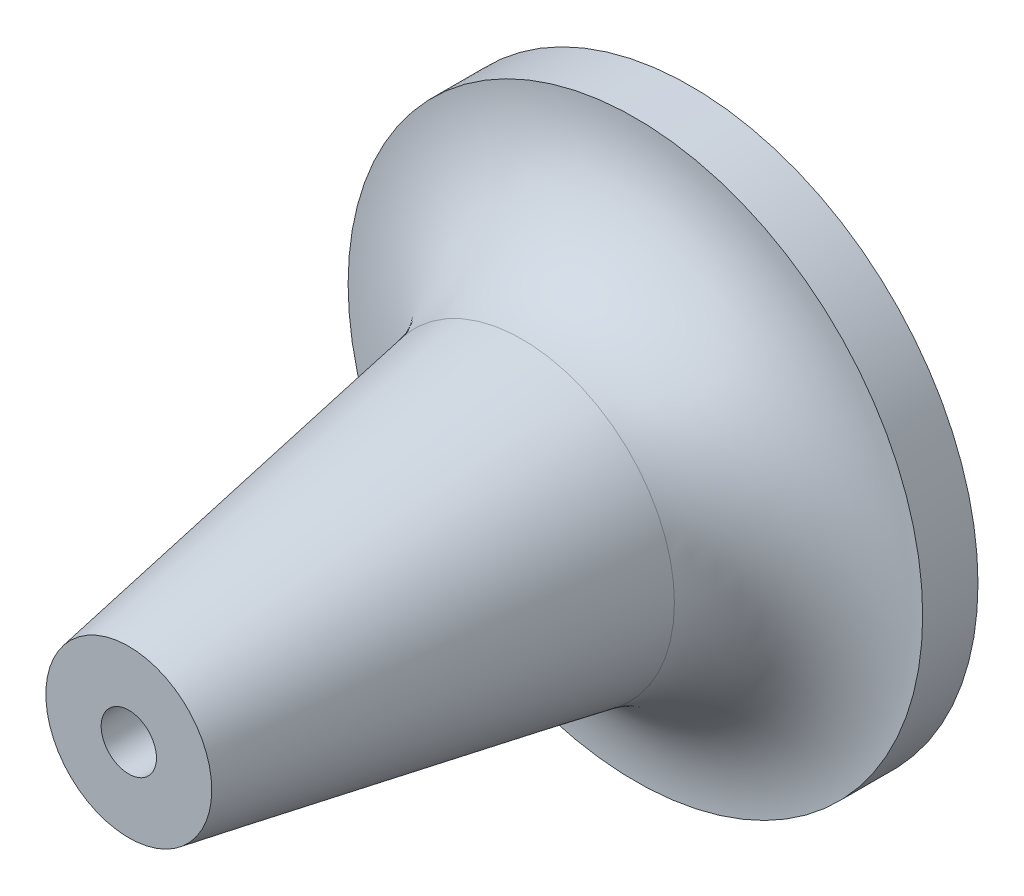
from build123d import *


with BuildPart() as part:
    # Sketch1 → Revolve1 (revolve)
    with BuildSketch(Plane(origin=(0, 0, 0), x_dir=(0, 0, -1), z_dir=(1, 0, 0)), mode=Mode.PRIVATE) as revolve1_sk:
        with BuildLine():
            Line((-31.363143696, 2.5), (19.436856304, 2.5))
            Line((19.436856304, 2.5), (19.436856304, 25.973744222))
            Line((19.436856304, 25.973744222), (14.436856304, 25.973744222))
            ThreePointArc((14.436856304, 25.973744222), (11.537722016, 18.008438229), (4.196856304, 13.770187434))
            Line((4.196856304, 13.770187434), (-31.363143696, 7.5))
            Line((-31.363143696, 7.5), (-31.363143696, 2.5))
        make_face()
    revolve(revolve1_sk.sketch.rotate(Axis((0, 0, 51.495497957), (0, 0, -1)), 90), axis=Axis((0, 0, 51.495497957), (0, 0, -1)))


solid = part.part
